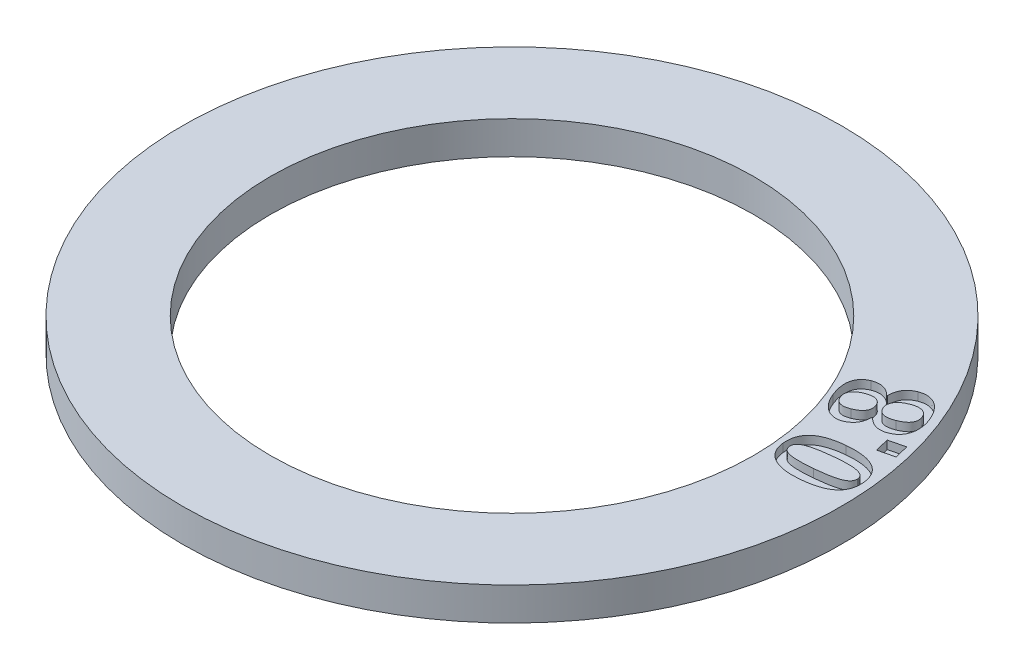
from build123d import *

# Parameters (mm, degrees)
SKETCH1_R           = 8.001
BOSS_EXTRUDE1_DEPTH = 0.8
SKETCH2_R           = 5.8674
CUT_EXTRUDE1_DEPTH  = 12.343368195
CUT_EXTRUDE2_DEPTH  = 0.2


with BuildPart() as part:
    # Sketch1 → Boss-Extrude1 (new body)
    with BuildSketch(Plane(origin=(0, 0, 0), x_dir=(1, 0, 0), z_dir=(0, 1, 0))):
        with Locations(Location((0, 0, 0), (0, 0, 270))):
            Circle(SKETCH1_R)
    extrude(amount=BOSS_EXTRUDE1_DEPTH)

    # Sketch2 → Cut-Extrude1 (cut, through all)
    with BuildSketch(Plane(origin=(0, 0, 0), x_dir=(-1, 0, 0), z_dir=(0, -1, 0))):
        with Locations(Location((0, 0, 0), (0, 0, 90))):
            Circle(SKETCH2_R)
    extrude(amount=-CUT_EXTRUDE1_DEPTH, mode=Mode.SUBTRACT)

    # Sketch4 → Cut-Extrude2 (cut)
    # profile 1 of 3: a face of its own
    with BuildSketch(Plane(origin=(0, 0.8, 0), x_dir=(1, 0, 0), z_dir=(0, 1, 0))):
        with BuildLine():
            add(Edge.make_bspline(
                [(7.767246669, 0.768228733), (7.768616681, 0.751777921), (7.771299992, 0.719557319), (7.771651226, 0.671847724), (7.768847829, 0.625994497), (7.763791281, 0.581665493), (7.754525531, 0.539395414), (7.743704494, 0.498411153), (7.728767986, 0.459603516), (7.711597242, 0.422178612), (7.690346507, 0.38684131), (7.666177088, 0.352853357), (7.638236216, 0.320709452), (7.606549541, 0.290467202), (7.571549975, 0.261408498), (7.532380513, 0.234700263), (7.490118852, 0.208976421), (7.444215831, 0.185169051), (7.394617995, 0.163124569), (7.341151112, 0.143032403), (7.283774168, 0.125099553), (7.22262746, 0.108861729), (7.15773129, 0.094649482), (7.088990392, 0.082380601), (7.016411757, 0.071901926), (6.966626953, 0.066709436), (6.941140332, 0.064051215)],
                knots=[0, 0, 0, 0, 0.959744186, 1.879757445, 2.771360733, 3.630433483, 4.470974874, 5.285729423, 6.092861057, 6.885868194, 7.677321799, 8.486806591, 9.30863703, 10.149710703, 11.031725224, 11.950856355, 12.90393232, 13.90755666, 14.955572763, 16.058595042, 17.227175211, 18.449982035, 19.736657795, 21.08935819, 22.509938377, 24, 24, 24, 24], degree=3))
            add(Edge.make_bspline(
                [(6.941140332, 0.064051215), (6.916974995, 0.061880059), (6.869600459, 0.057623652), (6.799552695, 0.05546182), (6.732246619, 0.054095152), (6.667515752, 0.056808837), (6.605390434, 0.060933713), (6.545892766, 0.069167948), (6.488793375, 0.078192436), (6.434684358, 0.091290062), (6.383159339, 0.106087129), (6.334547992, 0.124016841), (6.288435008, 0.14379007), (6.245679424, 0.166919217), (6.205071209, 0.191290458), (6.168116215, 0.219405569), (6.133618735, 0.249507551), (6.101916714, 0.281940861), (6.073178989, 0.316655739), (6.048138911, 0.354096013), (6.025624552, 0.393275429), (6.006775454, 0.434830179), (5.990860649, 0.478280184), (5.97804857, 0.523914814), (5.968933769, 0.571851451), (5.965003292, 0.604601182), (5.963008821, 0.621219618)],
                knots=[0, 0, 0, 0, 1.373964495, 2.693565985, 3.968553968, 5.185962309, 6.362128109, 7.493465967, 8.586945452, 9.634820339, 10.644545933, 11.621736809, 12.567827687, 13.483617295, 14.373243629, 15.247464012, 16.109610849, 16.964804151, 17.813643683, 18.658252232, 19.51307309, 20.370435758, 21.2393278, 22.1319618, 23.052087694, 24, 24, 24, 24], degree=3))
            add(Edge.make_bspline(
                [(5.963008821, 0.621219618), (5.961184373, 0.646930902), (5.95763602, 0.696936533), (5.96137283, 0.770131508), (5.971504627, 0.839027769), (5.989228129, 0.903508083), (6.014520014, 0.96357217), (6.04714147, 1.019062788), (6.086958764, 1.070172135), (6.134139349, 1.116694144), (6.188721214, 1.159142499), (6.251133852, 1.196622046), (6.320892733, 1.230357684), (6.39805777, 1.259957356), (6.483198664, 1.284783723), (6.575549001, 1.305930912), (6.675709611, 1.322447947), (6.745085036, 1.329983457), (6.781012294, 1.333885851)],
                knots=[0, 0, 0, 0, 0.999181933, 1.943299396, 2.836688392, 3.696188225, 4.530240668, 5.35776012, 6.186181664, 7.036493394, 7.921805995, 8.862264049, 9.85532249, 10.92466266, 12.06451709, 13.293082439, 14.598176172, 16, 16, 16, 16], degree=3))
            add(Edge.make_bspline(
                [(6.781012294, 1.333885851), (6.81803141, 1.33685429), (6.8896785, 1.34259943), (6.994289887, 1.344482115), (7.09247788, 1.340834394), (7.184314819, 1.331440489), (7.269728355, 1.316028511), (7.348801983, 1.295144467), (7.421216007, 1.267592042), (7.487377583, 1.234868523), (7.546865181, 1.196208576), (7.599372849, 1.151568024), (7.644857911, 1.101265586), (7.683986055, 1.045789028), (7.715146063, 0.984112878), (7.739851728, 0.917186349), (7.758380239, 0.84479307), (7.764241211, 0.794181785), (7.767246669, 0.768228733)],
                knots=[0, 0, 0, 0, 1.381791394, 2.674330027, 3.891007168, 5.036428095, 6.106690612, 7.117972597, 8.075364145, 8.985087285, 9.859944246, 10.708764313, 11.542333244, 12.37753583, 13.227367402, 14.105765436, 15.028652003, 16, 16, 16, 16], degree=3))
        make_face()
        with BuildLine():
            add(Edge.make_bspline(
                [(6.866671148, 0.452602865), (6.889697586, 0.454875299), (6.934491251, 0.4592959), (6.999872995, 0.466462648), (7.061538367, 0.47487975), (7.1196573, 0.482517183), (7.173836485, 0.491793094), (7.224500186, 0.500320864), (7.271415228, 0.510077719), (7.314968307, 0.519989326), (7.355047115, 0.530925535), (7.392230977, 0.54188216), (7.426327762, 0.554128369), (7.45792115, 0.566154622), (7.486549911, 0.579270405), (7.512216891, 0.59318471), (7.534954055, 0.607890264), (7.561267422, 0.627278523), (7.588091481, 0.654296895), (7.610574076, 0.691529303), (7.622579768, 0.732786526), (7.621540687, 0.76108619), (7.621009255, 0.775559896)],
                knots=[0, 0, 0, 0, 1.559939649, 3.034573339, 4.433834629, 5.755759396, 6.985974602, 8.139252337, 9.219098498, 10.216076828, 11.149973839, 12.019543174, 12.828554085, 13.591800542, 14.297942877, 14.949827997, 15.558345547, 16.121961591, 17.152098737, 18.100852136, 19.028691373, 20, 20, 20, 20], degree=3))
            add(Edge.make_bspline(
                [(7.621009255, 0.775559896), (7.619926587, 0.783444862), (7.617802115, 0.798917181), (7.611247364, 0.820913825), (7.601815494, 0.841113003), (7.589289355, 0.85946844), (7.573504688, 0.876151112), (7.554876253, 0.891806256), (7.532589397, 0.905483149), (7.507224363, 0.918389587), (7.478179436, 0.929907602), (7.445133323, 0.939893447), (7.407985388, 0.948278178), (7.366622767, 0.955112177), (7.320673845, 0.960565141), (7.26993871, 0.963996795), (7.214067393, 0.964849171), (7.153475824, 0.96443608), (7.088620395, 0.962639875), (7.020087861, 0.958426726), (6.948029164, 0.953644299), (6.898817126, 0.949169218), (6.87361646, 0.946877604)],
                knots=[0, 0, 0, 0, 0.573306212, 1.12497326, 1.647738541, 2.175091007, 2.719775143, 3.2992746, 3.924540973, 4.60063781, 5.349821626, 6.17422386, 7.087672211, 8.09400518, 9.19609116, 10.423188986, 11.759030231, 13.224456304, 14.792560164, 16.436793354, 18.175341204, 20, 20, 20, 20], degree=3))
            add(Edge.make_bspline(
                [(6.87361646, 0.946877604), (6.836687451, 0.943168116), (6.765837033, 0.936051252), (6.6642894, 0.923461037), (6.572167603, 0.909249697), (6.489397948, 0.893929398), (6.415975648, 0.877516996), (6.351671393, 0.859878624), (6.296531315, 0.841328265), (6.250231831, 0.821497208), (6.211722069, 0.800868735), (6.179827667, 0.779476626), (6.154312053, 0.756843646), (6.134327243, 0.733560472), (6.120632252, 0.708587263), (6.111522689, 0.682666394), (6.107088612, 0.655184126), (6.108005916, 0.636534703), (6.108474533, 0.627007378)],
                knots=[0, 0, 0, 0, 1.987774042, 3.813658246, 5.479624312, 6.979295976, 8.321212524, 9.507797241, 10.549079436, 11.434594746, 12.202068828, 12.886080949, 13.486172645, 14.024182533, 14.520633445, 15.002090577, 15.490203663, 16, 16, 16, 16], degree=3))
            add(Edge.make_bspline(
                [(6.108474533, 0.627007378), (6.109977202, 0.616105411), (6.112912381, 0.594810466), (6.124504195, 0.564901982), (6.141393458, 0.538156965), (6.163940725, 0.514563755), (6.192219175, 0.494509046), (6.225899733, 0.477658199), (6.264821299, 0.46332312), (6.309515168, 0.452424457), (6.359718904, 0.44419951), (6.415351194, 0.438023841), (6.476531013, 0.434692049), (6.543336384, 0.434110018), (6.615897868, 0.435798603), (6.694364654, 0.439369725), (6.778648309, 0.444614762), (6.836714922, 0.449884327), (6.866671148, 0.452602865)],
                knots=[0, 0, 0, 0, 0.622531695, 1.215998619, 1.802972471, 2.4067536, 3.054715399, 3.759494987, 4.537400922, 5.402670149, 6.364594255, 7.421637757, 8.576224243, 9.838461732, 11.210360544, 12.692839009, 14.293854979, 16, 16, 16, 16], degree=3))
        make_face(mode=Mode.SUBTRACT)
    # profile 2 of 3: a face of its own
    with BuildSketch(Plane(origin=(0, 0.8, 0), x_dir=(1, 0, 0), z_dir=(0, 1, 0))):
        Polygon((7.162360941, 1.945434774), (7.54473898, 2.039196493), (7.62846858, 1.69849033), (7.246090542, 1.604728611), align=None)
    # profile 3 of 3: a face of its own
    with BuildSketch(Plane(origin=(0, 0.8, 0), x_dir=(1, 0, 0), z_dir=(0, 1, 0))):
        with BuildLine():
            Line((6.216593275, 2.879710076), (6.231255602, 2.888198791))
            add(Edge.make_bspline(
                [(6.231255602, 2.888198791), (6.23134181, 2.901452441), (6.231511132, 2.927484151), (6.234679473, 2.965765544), (6.240026461, 3.002509898), (6.247724206, 3.037727076), (6.257793806, 3.071382252), (6.270031006, 3.103640666), (6.285296605, 3.134018519), (6.307862241, 3.172952646), (6.342618666, 3.217582168), (6.393358699, 3.263869723), (6.452000914, 3.30401395), (6.496097091, 3.323484099), (6.518714369, 3.333470492)],
                knots=[0, 0, 0, 0, 0.840641256, 1.651117264, 2.434692368, 3.194977497, 3.935924163, 4.661799768, 5.380716245, 6.090263358, 7.515187337, 8.947312832, 10.434252544, 12, 12, 12, 12], degree=3))
            add(Edge.make_bspline(
                [(6.518714369, 3.333470492), (6.542180315, 3.341744315), (6.588067005, 3.357923433), (6.659193074, 3.370201444), (6.729678493, 3.369917486), (6.79925319, 3.35917356), (6.867123247, 3.33698953), (6.932331651, 3.303443636), (6.994816853, 3.259470653), (7.053670645, 3.204513765), (7.109310972, 3.140342892), (7.160187009, 3.066708199), (7.205923316, 2.983980676), (7.231383747, 2.924584244), (7.244499525, 2.893986552)],
                knots=[0, 0, 0, 0, 0.939312875, 1.836787574, 2.711797682, 3.592527971, 4.487220492, 5.398141499, 6.354322103, 7.365748672, 8.434011609, 9.558655028, 10.742356744, 12, 12, 12, 12], degree=3))
            add(Edge.make_bspline(
                [(7.244499525, 2.893986552), (7.255683698, 2.864318978), (7.277393722, 2.806730118), (7.300622861, 2.720071007), (7.3148163, 2.636477526), (7.32011439, 2.556272662), (7.316145738, 2.47989516), (7.302669065, 2.408367575), (7.280218719, 2.341625413), (7.248066759, 2.280646293), (7.207466733, 2.225536331), (7.157504861, 2.178394884), (7.099392979, 2.138269447), (7.055796667, 2.118776794), (7.033439196, 2.108780388)],
                knots=[0, 0, 0, 0, 1.247985073, 2.422511498, 3.526618922, 4.582168067, 5.581502257, 6.530149015, 7.439910714, 8.343859269, 9.234269096, 10.122717666, 11.037274389, 12, 12, 12, 12], degree=3))
            add(Edge.make_bspline(
                [(7.033439196, 2.108780388), (7.016717435, 2.10245833), (6.984044618, 2.090105598), (6.934078598, 2.0788229), (6.885462633, 2.072604967), (6.838121585, 2.073071979), (6.792710436, 2.079156011), (6.748917567, 2.088633057), (6.707240737, 2.102921097), (6.66752487, 2.121867221), (6.628889015, 2.144420015), (6.591223582, 2.171542394), (6.552798815, 2.201303271), (6.528453922, 2.223828683), (6.516013414, 2.235339416)],
                knots=[0, 0, 0, 0, 1.131766482, 2.211369968, 3.237616582, 4.232132007, 5.201748462, 6.13718322, 7.067775192, 7.986690967, 8.921983648, 9.898973199, 10.926352269, 12, 12, 12, 12], degree=3))
            Line((6.516013414, 2.235339416), (6.501351088, 2.226850701))
            add(Edge.make_bspline(
                [(6.501351088, 2.226850701), (6.499943271, 2.201822213), (6.4972206, 2.153417935), (6.482625545, 2.084145355), (6.460689777, 2.020863866), (6.428973893, 1.964617473), (6.390415885, 1.913916227), (6.342271106, 1.871044602), (6.286901263, 1.833507425), (6.245355766, 1.815032216), (6.223924439, 1.805501742)],
                knots=[0, 0, 0, 0, 1.116876958, 2.16000353, 3.147273899, 4.092432046, 5.028929989, 5.975289022, 6.955548782, 8, 8, 8, 8], degree=3))
            add(Edge.make_bspline(
                [(6.223924439, 1.805501742), (6.203540795, 1.798323349), (6.163156856, 1.784101565), (6.099385498, 1.776004616), (6.035117615, 1.778293991), (5.970810617, 1.791755176), (5.907140497, 1.815438897), (5.845433323, 1.850062343), (5.785568934, 1.894431297), (5.729031669, 1.949100793), (5.675461782, 2.011475939), (5.627933202, 2.082118967), (5.583951471, 2.158443407), (5.560596894, 2.213455876), (5.548685723, 2.241513027)],
                knots=[0, 0, 0, 0, 0.868450723, 1.72056872, 2.570778946, 3.44863588, 4.355147423, 5.296632486, 6.28928225, 7.348297526, 8.458113701, 9.594776199, 10.773301217, 12, 12, 12, 12], degree=3))
            add(Edge.make_bspline(
                [(5.548685723, 2.241513027), (5.539393363, 2.265332256), (5.521376033, 2.311516311), (5.499942417, 2.380296819), (5.483047266, 2.445798966), (5.471268866, 2.508167824), (5.465053652, 2.567529732), (5.463569641, 2.623711306), (5.467865005, 2.676836235), (5.476920125, 2.726836734), (5.491423191, 2.773480988), (5.510026032, 2.816836537), (5.534107787, 2.856297348), (5.562194116, 2.892463635), (5.59560716, 2.924625932), (5.632965334, 2.95381917), (5.675638864, 2.97857515), (5.706229335, 2.992030668), (5.721932685, 2.99893794)],
                knots=[0, 0, 0, 0, 1.396361622, 2.707461358, 3.932725029, 5.090324368, 6.171197201, 7.190216201, 8.155905293, 9.077839834, 9.960154348, 10.819107161, 11.648140816, 12.478840155, 13.313570888, 14.175077509, 15.063192017, 16, 16, 16, 16], degree=3))
            add(Edge.make_bspline(
                [(5.721932685, 2.99893794), (5.743343057, 3.006710658), (5.785142905, 3.021885472), (5.850135117, 3.032484184), (5.914284922, 3.033441754), (5.977881381, 3.024029641), (6.040637135, 3.004171965), (6.101609111, 2.972941378), (6.161427121, 2.931649384), (6.197735621, 2.897464685), (6.216593275, 2.879710076)],
                knots=[0, 0, 0, 0, 1.005971034, 1.963975065, 2.897322963, 3.834911603, 4.795986871, 5.79616273, 6.855386447, 8, 8, 8, 8], degree=3))
        make_face()
        with BuildLine():
            add(Edge.make_bspline(
                [(6.068812459, 2.163571187), (6.08146989, 2.168984929), (6.106134222, 2.179534175), (6.14110015, 2.196797862), (6.173163114, 2.214875052), (6.201636114, 2.234620078), (6.227218988, 2.255199747), (6.250232485, 2.276204145), (6.269674882, 2.298819288), (6.285891243, 2.322404827), (6.299251582, 2.346742866), (6.308868337, 2.372105995), (6.315609698, 2.398093556), (6.318650989, 2.424835655), (6.318240447, 2.452324308), (6.314198701, 2.480362132), (6.307283008, 2.509382291), (6.300152527, 2.528397049), (6.296464369, 2.538232211)],
                knots=[0, 0, 0, 0, 1.327232906, 2.586252761, 3.758410819, 4.87299417, 5.922767675, 6.923100545, 7.872796287, 8.791289235, 9.679128699, 10.54281967, 11.400075767, 12.261537855, 13.129758006, 14.043550173, 14.988049182, 16, 16, 16, 16], degree=3))
            add(Edge.make_bspline(
                [(6.296464369, 2.538232211), (6.292382919, 2.547569923), (6.284447236, 2.565725511), (6.270203308, 2.590882804), (6.254093213, 2.613182), (6.23666224, 2.633099464), (6.216437873, 2.649215887), (6.19528602, 2.663511358), (6.171857952, 2.674157646), (6.147018667, 2.682337673), (6.120599348, 2.687702852), (6.092799523, 2.690347119), (6.06360661, 2.690284123), (6.033150554, 2.687522218), (6.001299076, 2.682030268), (5.96825893, 2.673752834), (5.933584477, 2.663491983), (5.910550308, 2.654425986), (5.898652303, 2.649743062)],
                knots=[0, 0, 0, 0, 1.0400626, 2.022224464, 2.944254982, 3.84614748, 4.713736326, 5.576941369, 6.446416389, 7.330933473, 8.242619619, 9.192561868, 10.177441371, 11.218912317, 12.311295192, 13.473805358, 14.695126542, 16, 16, 16, 16], degree=3))
            add(Edge.make_bspline(
                [(5.898652303, 2.649743062), (5.886619953, 2.644756348), (5.863265969, 2.635077471), (5.830321255, 2.618330173), (5.800304522, 2.600662288), (5.773040419, 2.582202757), (5.748959945, 2.562364091), (5.727741171, 2.541617134), (5.709326853, 2.519905745), (5.69424635, 2.497069293), (5.682256279, 2.473490336), (5.673125401, 2.449197937), (5.667413812, 2.424141799), (5.664712075, 2.398375124), (5.664949461, 2.372031604), (5.669300004, 2.345107114), (5.675444244, 2.317263914), (5.682459573, 2.29905826), (5.686048571, 2.289744364)],
                knots=[0, 0, 0, 0, 1.316961794, 2.556134436, 3.734118338, 4.838245977, 5.882590732, 6.885270393, 7.836326818, 8.756361657, 9.646480785, 10.506725807, 11.374511398, 12.237898161, 13.122582415, 14.029557256, 14.991934074, 16, 16, 16, 16], degree=3))
            add(Edge.make_bspline(
                [(5.686048571, 2.289744364), (5.690131434, 2.280152354), (5.698071052, 2.261499536), (5.71229859, 2.235569438), (5.728399796, 2.212595657), (5.745508164, 2.191947836), (5.764805203, 2.174663014), (5.784801187, 2.159115237), (5.807096491, 2.14728918), (5.830775694, 2.137913235), (5.855928834, 2.13146715), (5.882307467, 2.127430817), (5.910116867, 2.127035153), (5.939321657, 2.128319141), (5.969881166, 2.133216156), (6.001696922, 2.140648788), (6.034957954, 2.15069092), (6.057286549, 2.159186045), (6.068812459, 2.163571187)],
                knots=[0, 0, 0, 0, 1.086000131, 2.111858004, 3.074847417, 4.006739957, 4.898438829, 5.769654882, 6.639323022, 7.517931094, 8.418450943, 9.339679637, 10.291693117, 11.311755633, 12.382764245, 13.510954748, 14.715167132, 16, 16, 16, 16], degree=3))
        make_face(mode=Mode.SUBTRACT)
        with BuildLine():
            add(Edge.make_bspline(
                [(6.857105428, 2.463763027), (6.870916528, 2.469565152), (6.897774329, 2.480848275), (6.935986703, 2.499124695), (6.970405272, 2.518943449), (7.001418222, 2.539331145), (7.029072959, 2.560685172), (7.053418333, 2.582840321), (7.074012857, 2.606196152), (7.091346541, 2.630247953), (7.104741757, 2.655543114), (7.115499377, 2.681393984), (7.122018862, 2.708473361), (7.125091449, 2.736216721), (7.124651601, 2.764855938), (7.120679213, 2.794216512), (7.113365009, 2.824508328), (7.105935936, 2.844409317), (7.102120619, 2.854629781)],
                knots=[0, 0, 0, 0, 1.369390652, 2.662990204, 3.869043802, 4.997341485, 6.053299299, 7.060134295, 8.00140078, 8.895285223, 9.7632772, 10.612593574, 11.448125692, 12.299880067, 13.158262981, 14.059540116, 15.003446494, 16, 16, 16, 16], degree=3))
            add(Edge.make_bspline(
                [(7.102120619, 2.854629781), (7.096642074, 2.867001611), (7.085959074, 2.891126313), (7.065220055, 2.92378395), (7.040328609, 2.951101983), (7.012848091, 2.974338925), (6.981533346, 2.992349274), (6.946479183, 3.004720155), (6.907967339, 3.011911861), (6.866226457, 3.014004602), (6.821804802, 3.011324922), (6.775225194, 3.002809161), (6.726403552, 2.989714564), (6.693795968, 2.977487396), (6.676913154, 2.97115669)],
                knots=[0, 0, 0, 0, 0.974103022, 1.899471894, 2.772164063, 3.627613838, 4.482762416, 5.359185734, 6.293328698, 7.295672438, 8.363311999, 9.492211638, 10.701574354, 12, 12, 12, 12], degree=3))
            add(Edge.make_bspline(
                [(6.676913154, 2.97115669), (6.659914827, 2.964011147), (6.626932297, 2.950146366), (6.58152579, 2.924879089), (6.54072218, 2.897825014), (6.505463026, 2.868146934), (6.474775831, 2.837089054), (6.450880783, 2.803477646), (6.431766755, 2.768827464), (6.419015817, 2.732450198), (6.412374259, 2.695176936), (6.411918855, 2.657348677), (6.418196656, 2.619290731), (6.426767075, 2.594717775), (6.431126262, 2.58221919)],
                knots=[0, 0, 0, 0, 1.284784317, 2.492918005, 3.617159611, 4.693040781, 5.70147613, 6.652238095, 7.559056451, 8.452472812, 9.32678132, 10.187742238, 11.078228249, 12, 12, 12, 12], degree=3))
            add(Edge.make_bspline(
                [(6.431126262, 2.58221919), (6.437379964, 2.567968909), (6.449306641, 2.540791648), (6.473396668, 2.505152845), (6.500443127, 2.475390475), (6.531913901, 2.453001285), (6.565774918, 2.436089167), (6.602141219, 2.425481642), (6.640286528, 2.419521029), (6.680525967, 2.419401312), (6.722503356, 2.424258636), (6.7661604, 2.433392853), (6.811612155, 2.445898161), (6.841640235, 2.457689962), (6.857105428, 2.463763027)],
                knots=[0, 0, 0, 0, 1.111638409, 2.120048397, 3.064373163, 3.973918209, 4.867202445, 5.761197764, 6.673765258, 7.621895543, 8.631271301, 9.692730955, 10.811700222, 12, 12, 12, 12], degree=3))
        make_face(mode=Mode.SUBTRACT)
    extrude(amount=-CUT_EXTRUDE2_DEPTH, mode=Mode.SUBTRACT)


solid = part.part
